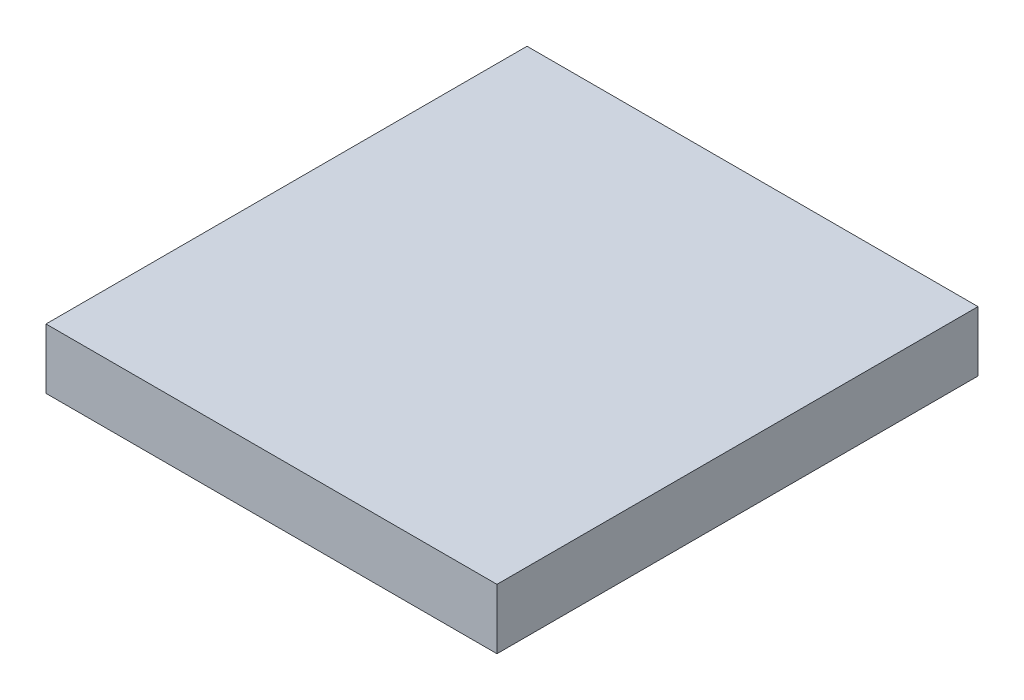
from build123d import *

# Parameters (mm, degrees)
SKETCH1_W               = 150
SKETCH1_H               = 160
BOSS_EXTRUDE1_DEPTH     = 20
CUT_EXTRUDE1_DEPTH      = 15
CUT_EXTRUDE1_DEPTH_BACK = 15
SKETCH2_W               = 60
SKETCH2_H               = 67.5
CUT_EXTRUDE6_DEPTH      = 10
CUT_EXTRUDE6_DEPTH_BACK = 0.1
REVOLVE2_ANGLE          = 180
REVOLVE3_ANGLE          = 180
REVOLVE4_ANGLE          = 180
REVOLVE5_ANGLE          = 180
REVOLVE6_ANGLE          = 180
REVOLVE7_ANGLE          = 180
REVOLVE8_ANGLE          = 180
REVOLVE9_ANGLE          = 180
REVOLVE10_ANGLE         = 180
REVOLVE11_ANGLE         = 180


with BuildPart() as part:
    # Sketch1 → Boss-Extrude1 (new body)
    with BuildSketch(Plane(origin=(0, 0, 0), x_dir=(1, 0, 0), z_dir=(0, 1, 0))):
        with Locations((0.216138329, 49.200288184)):
            Rectangle(SKETCH1_W, SKETCH1_H)
    extrude(amount=BOSS_EXTRUDE1_DEPTH)

    # Sketch2 → Cut-Extrude1 (cut, two sides: drawn at the far end of the back side and taken through both)
    with BuildSketch(Plane(origin=(0, 0, 0), x_dir=(1, 0, 0), z_dir=(0, 1, 0)).offset(-CUT_EXTRUDE1_DEPTH_BACK)):
        with Locations((-29.783861671, 62.950288184)):
            Rectangle(SKETCH2_W, SKETCH2_H)
    extrude(amount=CUT_EXTRUDE1_DEPTH + CUT_EXTRUDE1_DEPTH_BACK, mode=Mode.SUBTRACT)

    # Sketch3 → Cut-Revolve1 (revolve, cut)
    with BuildSketch(Plane(origin=(0, 0, 0), x_dir=(1, 0, 0), z_dir=(0, 1, 0))):
        Polygon((0.216138329, 96.700288184), (40.216138329, 95.450288184), (40.216138329, 89.200288184), (0.216138329, 89.200288184), align=None)
    revolve(axis=Axis((0.216138329, 0, -89.200288184), (1, 0, 0)), mode=Mode.SUBTRACT)

    # Sketch4 → Cut-Revolve2 (revolve, cut)
    with BuildSketch(Plane(origin=(0, 0, 0), x_dir=(1, 0, 0), z_dir=(0, 1, 0))):
        Polygon((0.216138329, 79.200288184), (60.216138329, 77.950288184), (60.216138329, 71.700288184), (0.216138329, 71.700288184), align=None)
    revolve(axis=Axis((94.987400497, 0, -71.700288184), (-1, 0, 0)), mode=Mode.SUBTRACT)

    # Sketch6 → Cut-Revolve3 (revolve, cut)
    with BuildSketch(Plane(origin=(0, 0, 0), x_dir=(1, 0, 0), z_dir=(0, 1, 0))):
        Polygon((0.216138329, 61.700288184), (60.216138329, 60.450288184), (60.216138329, 54.200288184), (0.216138329, 54.200288184), align=None)
    revolve(axis=Axis((60.216138329, 0, -54.200288184), (-1, 0, 0)), mode=Mode.SUBTRACT)

    # Sketch7 → Cut-Revolve4 (revolve, cut)
    with BuildSketch(Plane(origin=(0, 0, 0), x_dir=(1, 0, 0), z_dir=(0, 1, 0))):
        Polygon((0.216138329, 44.200288184), (60.216138329, 42.950288184), (60.216138329, 36.700288184), (0.216138329, 36.700288184), align=None)
    revolve(axis=Axis((60.216138329, 0, -36.700288184), (-1, 0, 0)), mode=Mode.SUBTRACT)

    # Sketch11 → Cut-Revolve5 (revolve, cut)
    with BuildSketch(Plane(origin=(0, 0, 0), x_dir=(1, 0, 0), z_dir=(0, 1, 0))):
        Polygon((-46.143861671, 29.200288184), (28.762467917, 1.110400544), (31.395894883, 8.132868943), (-24.783861671, 29.200288184), align=None)
    revolve(axis=Axis((28.762467917, 0, -1.110400544), (-0.9363291198500703, 0, -0.35112359550561795)), mode=Mode.SUBTRACT)

    # Sketch13 → Cut-Extrude6 (cut, two sides: drawn at the far end of the back side and taken through both)
    with BuildSketch(Plane(origin=(0, 0, 0), x_dir=(1, 0, 0), z_dir=(0, 1, 0)).offset(-CUT_EXTRUDE6_DEPTH_BACK)):
        Polygon((-30.050715604, 15.155351387), (-24.783861671, 29.200288184), (-46.143861671, 29.200288184), align=None)
    extrude(amount=CUT_EXTRUDE6_DEPTH + CUT_EXTRUDE6_DEPTH_BACK, mode=Mode.SUBTRACT)

    # Sketch15 → Revolve2 (revolve)
    with BuildSketch(Plane(origin=(0, 0, 0), x_dir=(1, 0, 0), z_dir=(0, 1, 0))):
        Polygon((50.216138329, 30.241954851), (37.716138329, 29.981538184), (37.716138329, 31.481538184), (50.216138329, 31.741954851), align=None)
    revolve(axis=Axis((60.216138329, 0, -36.700288184), (-1, 0, 0)), revolution_arc=REVOLVE2_ANGLE)

    # Sketch16 → Revolve3 (revolve)
    with BuildSketch(Plane(origin=(0, 0, 0), x_dir=(1, 0, 0), z_dir=(0, 1, 0))):
        Polygon((25.216138329, 29.721121518), (12.716138329, 29.460704851), (12.716138329, 30.960704851), (25.216138329, 31.221121518), align=None)
    revolve(axis=Axis((60.216138329, 0, -36.700288184), (-1, 0, 0)), revolution_arc=REVOLVE3_ANGLE)

    # Sketch17 → Revolve4 (revolve)
    with BuildSketch(Plane(origin=(0, 0, 0), x_dir=(1, 0, 0), z_dir=(0, 1, 0))):
        Polygon((50.216138329, 47.741954851), (50.216138329, 49.241954851), (37.716138329, 48.981538184), (37.716138329, 47.481538184), align=None)
    revolve(axis=Axis((60.216138329, 0, -54.200288184), (-1, 0, 0)), revolution_arc=REVOLVE4_ANGLE)

    # Sketch18 → Revolve5 (revolve)
    with BuildSketch(Plane(origin=(0, 0, 0), x_dir=(1, 0, 0), z_dir=(0, 1, 0))):
        Polygon((25.216138329, 47.221121518), (25.216138329, 48.721121518), (12.716138329, 48.460704851), (12.716138329, 46.960704851), align=None)
    revolve(axis=Axis((60.216138329, 0, -54.200288184), (-1, 0, 0)), revolution_arc=REVOLVE5_ANGLE)

    # Sketch19 → Revolve6 (revolve)
    with BuildSketch(Plane(origin=(0, 0, 0), x_dir=(1, 0, 0), z_dir=(0, 1, 0))):
        Polygon((50.216138329, 65.241954851), (50.216138329, 66.741954851), (37.716138329, 66.481538184), (37.716138329, 64.981538184), align=None)
    revolve(axis=Axis((60.216138329, 0, -71.700288184), (-1, 0, 0)), revolution_arc=REVOLVE6_ANGLE)

    # Sketch20 → Revolve7 (revolve)
    with BuildSketch(Plane(origin=(0, 0, 0), x_dir=(1, 0, 0), z_dir=(0, 1, 0))):
        Polygon((25.216138329, 66.221121518), (25.216138329, 64.721121518), (12.716138329, 64.460704851), (12.716138329, 65.960704851), align=None)
    revolve(axis=Axis((60.216138329, 0, -71.700288184), (-1, 0, 0)), revolution_arc=REVOLVE7_ANGLE)

    # Sketch21 → Revolve8 (revolve)
    with BuildSketch(Plane(origin=(0, 0, 0), x_dir=(1, 0, 0), z_dir=(0, 1, 0))):
        Polygon((32.716138329, 82.715913184), (32.716138329, 84.215913184), (23.341138329, 83.922944434), (23.341138329, 82.422944434), align=None)
    revolve(axis=Axis((40.216138329, 0, -89.200288184), (-1, 0, 0)), revolution_arc=REVOLVE8_ANGLE)

    # Sketch22 → Revolve9 (revolve)
    with BuildSketch(Plane(origin=(0, 0, 0), x_dir=(1, 0, 0), z_dir=(0, 1, 0))):
        Polygon((13.966138329, 82.129975684), (13.966138329, 83.629975684), (4.591138329, 83.337006934), (4.591138329, 81.837006934), align=None)
    revolve(axis=Axis((40.216138329, 0, -89.200288184), (-1, 0, 0)), revolution_arc=REVOLVE9_ANGLE)

    # Sketch23 → Revolve10 (revolve)
    with BuildSketch(Plane(origin=(0, 0, 0), x_dir=(1, 0, 0), z_dir=(0, 1, 0))):
        Polygon((17.292435145, -0.99633822), (16.765749752, -2.4008319), (5.061635754, 1.988213044), (5.588321147, 3.392706724), align=None)
    revolve(axis=Axis((28.762467917, 0, -1.110400544), (-0.9363291198500702, 0, -0.35112359550561806)), revolution_arc=REVOLVE10_ANGLE)

    # Sketch25 → Revolve11 (revolve)
    with BuildSketch(Plane(origin=(0, 0, 0), x_dir=(1, 0, 0), z_dir=(0, 1, 0))):
        Polygon((-6.115792851, 7.781751668), (-6.642478245, 6.377257988), (-18.346592243, 10.766302932), (-17.819906849, 12.170796611), align=None)
    revolve(axis=Axis((28.762467917, 0, -1.110400544), (-0.9363291198500703, 0, -0.351123595505618)), revolution_arc=REVOLVE11_ANGLE)


solid = part.part
